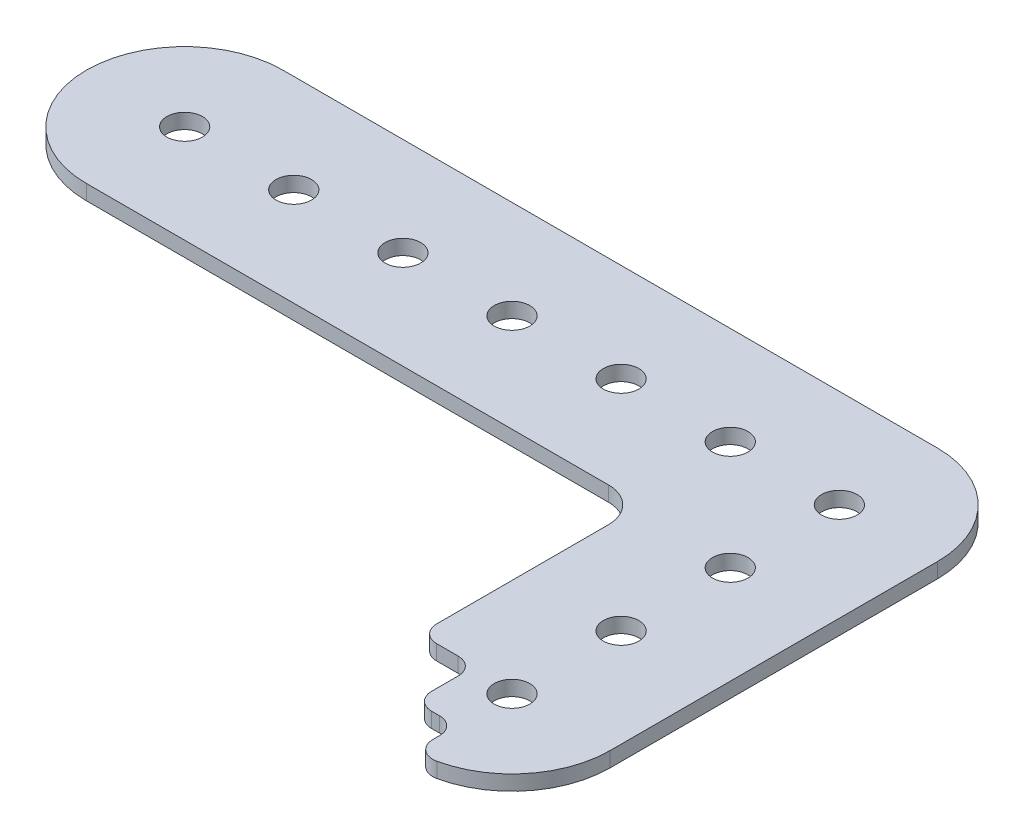
from build123d import *

# Parameters (mm, degrees)
SKETCH1_R               = 2.07
BOSS_EXTRUDE1_DEPTH     = 0.875
FILLET1_R               = 4
CUT_EXTRUDE3_DEPTH      = 101.674228579
CUT_EXTRUDE3_DEPTH_BACK = 101.674228579
CUT_EXTRUDE4_DEPTH      = 101.674228579
CUT_EXTRUDE4_DEPTH_BACK = 101.674228579
FILLET3_R               = 2


with BuildPart() as part:
    # Sketch1 → Boss-Extrude1 (new, symmetric)
    with BuildSketch(Plane(origin=(0, 0, 0), x_dir=(1, 0, 0), z_dir=(0, 1, 0))):
        with BuildLine():
            Line((0, 11.43), (-76.2, 11.43))
            ThreePointArc((-76.2, 11.43), (-87.63, 0), (-76.2, -11.43))
            Line((-76.2, -11.43), (-11.43, -11.43))
            Line((-11.43, -11.43), (-11.43, -38.1))
            ThreePointArc((-11.43, -38.1), (0, -49.53), (11.43, -38.1))
            Line((11.43, -38.1), (11.43, 0))
            ThreePointArc((11.43, 0), (8.082230509, 8.082230509), (0, 11.43))
        make_face()
        with Locations(Location((0, -25.4, 0), (0, 0, 270))):
            Circle(SKETCH1_R, mode=Mode.SUBTRACT)
        with Locations(Location((0, -12.7, 0), (0, 0, 270))):
            Circle(SKETCH1_R, mode=Mode.SUBTRACT)
        with Locations(Location((-12.7, 0, 0), (0, 0, 270))):
            Circle(SKETCH1_R, mode=Mode.SUBTRACT)
        with Locations(Location((-63.5, 0, 0), (0, 0, 270))):
            Circle(SKETCH1_R, mode=Mode.SUBTRACT)
        with Locations(Location((-50.8, 0, 0), (0, 0, 270))):
            Circle(SKETCH1_R, mode=Mode.SUBTRACT)
        with Locations(Location((-38.1, 0, 0), (0, 0, 270))):
            Circle(SKETCH1_R, mode=Mode.SUBTRACT)
        with Locations(Location((-25.4, 0, 0), (0, 0, 270))):
            Circle(SKETCH1_R, mode=Mode.SUBTRACT)
        with Locations(Location((-76.2, 0, 0), (0, 0, 270))):
            Circle(SKETCH1_R, mode=Mode.SUBTRACT)
        with Locations(Location((0, 0, 0), (0, 0, 270))):
            Circle(SKETCH1_R, mode=Mode.SUBTRACT)
        with Locations(Location((0, -38.1, 0), (0, 0, 270))):
            Circle(SKETCH1_R, mode=Mode.SUBTRACT)
    extrude(amount=BOSS_EXTRUDE1_DEPTH, both=True)

    # Fillet1
    fillet1_edges = [part.edges().sort_by_distance(p)[0] for p in [
        (-11.43, 0, 11.43),
    ]]
    fillet(fillet1_edges, radius=FILLET1_R)

    # Sketch4 → Cut-Extrude3 (cut, two sides: drawn at the far end of the back side and taken through both)
    with BuildSketch(Plane(origin=(0, 0.875, 0), x_dir=(1, 0, 0), z_dir=(0, 1, 0)).offset(-CUT_EXTRUDE3_DEPTH_BACK)):
        with BuildLine():
            Line((-4.93, -37.43), (-4.93, -48.412128781))
            ThreePointArc((-4.93, -48.412128781), (-9.669405359, -44.194874896), (-11.43, -38.1))
            Line((-11.43, -38.1), (-11.43, -37.43))
            Line((-11.43, -37.43), (-4.93, -37.43))
        make_face()
    extrude(amount=CUT_EXTRUDE3_DEPTH + CUT_EXTRUDE3_DEPTH_BACK, mode=Mode.SUBTRACT)

    # Sketch5 → Cut-Extrude4 (cut, two sides: drawn at the far end of the back side and taken through both)
    with BuildSketch(Plane(origin=(0, 0.875, 0), x_dir=(1, 0, 0), z_dir=(0, 1, 0)).offset(-CUT_EXTRUDE4_DEPTH_BACK)):
        with BuildLine():
            Line((-4.93, -44.53), (0, -44.53))
            Line((0, -44.53), (0, -49.53))
            ThreePointArc((0, -49.53), (-2.52757473, -49.247029469), (-4.93, -48.412128781))
            Line((-4.93, -48.412128781), (-4.93, -44.53))
        make_face()
    extrude(amount=CUT_EXTRUDE4_DEPTH + CUT_EXTRUDE4_DEPTH_BACK, mode=Mode.SUBTRACT)

    # Fillet3
    fillet3_edges = [part.edges().sort_by_distance(p)[0] for p in [
        (0, 0, 49.53),
        (0, 0, 44.53),
        (-4.93, 0, 44.53),
        (-4.93, 0, 37.43),
        (-11.43, 0, 37.43),
    ]]
    fillet(fillet3_edges, radius=FILLET3_R)


solid = part.part
